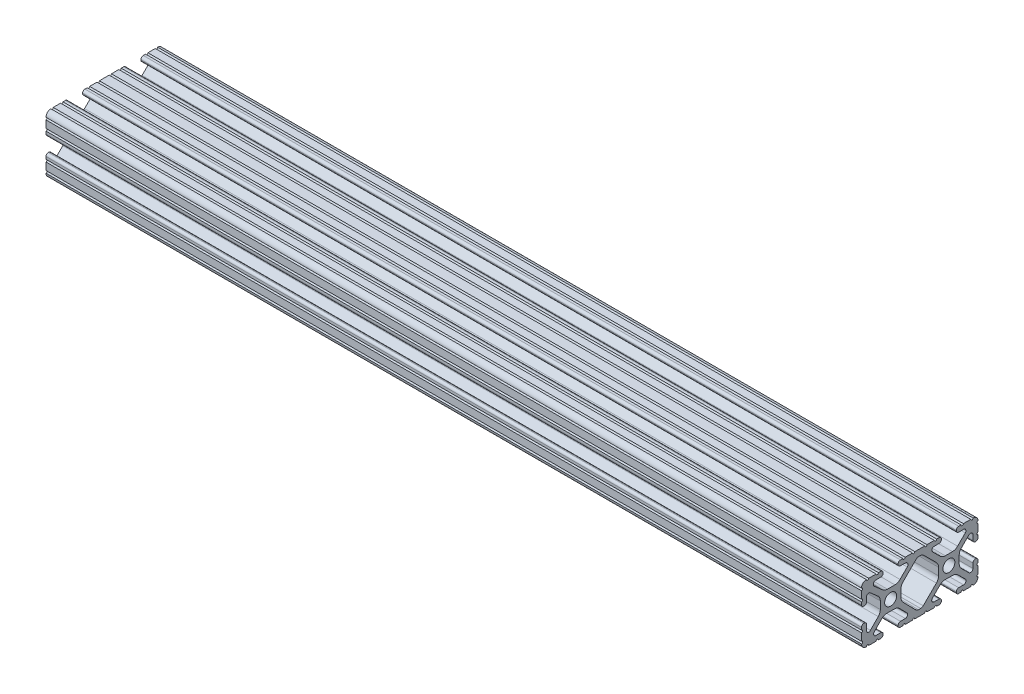
from build123d import *

# Parameters (mm, degrees)
SKETCH11_R                = 2.6035
F_10_1020_PROFILE_1_DEPTH = 355.6


with BuildPart() as part:
    # Sketch11 → 10 1020 PROFILE(1) (new body)
    with BuildSketch(Plane(origin=(0, 0, 0), x_dir=(0, 0, 1), z_dir=(1, 0, 0))):
        with BuildLine():
            Line((15.9385, 11.65104985), (15.9385, 11.53922))
            ThreePointArc((15.9385, 11.53922), (16.245750844, 10.797450844), (16.98752, 10.4902))
            Line((16.98752, 10.4902), (19.116384363, 10.4902))
            ThreePointArc((19.116384363, 10.4902), (20.052502933, 9.869096983), (19.844087081, 8.765172272))
            Line((19.844087081, 8.765172272), (16.618993479, 5.455112286))
            ThreePointArc((16.618993479, 5.455112286), (15.578994274, 4.745442459), (14.344932584, 4.4958))
            Line((14.344932584, 4.4958), (11.083317835, 4.4958))
            ThreePointArc((11.083317835, 4.4958), (9.854330953, 4.743306833), (8.816955189, 5.447238587))
            Line((8.816955189, 5.447238587), (5.564154119, 8.762652677))
            ThreePointArc((5.564154119, 8.762652677), (5.352591412, 9.867473037), (6.289393385, 10.4902))
            Line((6.289393385, 10.4902), (8.41248, 10.4902))
            ThreePointArc((8.41248, 10.4902), (9.154249156, 10.797450844), (9.4615, 11.53922))
            Line((9.4615, 11.53922), (9.4615, 11.65104985))
            ThreePointArc((9.4615, 11.65104985), (9.154269614, 12.392769614), (8.41254985, 12.7))
            Line((8.41254985, 12.7), (7.38288465, 12.7))
            ThreePointArc((7.38288465, 12.7), (6.87488465, 12.192), (6.36688465, 12.7))
            Line((6.36688465, 12.7), (3.14958095, 12.7))
            ThreePointArc((3.14958095, 12.7), (2.64158095, 12.192), (2.13358095, 12.7))
            Line((2.13358095, 12.7), (-2.13358095, 12.7))
            ThreePointArc((-2.13358095, 12.7), (-2.64158095, 12.192), (-3.14958095, 12.7))
            Line((-3.14958095, 12.7), (-6.36689735, 12.7))
            ThreePointArc((-6.36689735, 12.7), (-6.87489735, 12.192), (-7.38289735, 12.7))
            Line((-7.38289735, 12.7), (-8.41254985, 12.7))
            ThreePointArc((-8.41254985, 12.7), (-9.154269614, 12.392769614), (-9.4615, 11.65104985))
            Line((-9.4615, 11.65104985), (-9.4615, 11.53922))
            ThreePointArc((-9.4615, 11.53922), (-9.154249156, 10.797450844), (-8.41248, 10.4902))
            Line((-8.41248, 10.4902), (-6.283641037, 10.4902))
            ThreePointArc((-6.283641037, 10.4902), (-5.297291557, 9.829633109), (-5.532576693, 8.666071843))
            Line((-5.532576693, 8.666071843), (-8.809985098, 5.416263103))
            ThreePointArc((-8.809985098, 5.416263103), (-9.836720513, 4.734920264), (-11.045536121, 4.4958))
            Line((-11.045536121, 4.4958), (-14.354463879, 4.4958))
            ThreePointArc((-14.354463879, 4.4958), (-15.563279487, 4.734920264), (-16.590014902, 5.416263103))
            Line((-16.590014902, 5.416263103), (-19.867423307, 8.666071843))
            ThreePointArc((-19.867423307, 8.666071843), (-20.102708443, 9.829633109), (-19.116358963, 10.4902))
            Line((-19.116358963, 10.4902), (-16.98752, 10.4902))
            ThreePointArc((-16.98752, 10.4902), (-16.245750844, 10.797450844), (-15.9385, 11.53922))
            Line((-15.9385, 11.53922), (-15.9385, 11.65104985))
            ThreePointArc((-15.9385, 11.65104985), (-16.245730386, 12.392769614), (-16.98745015, 12.7))
            Line((-16.98745015, 12.7), (-18.01711535, 12.7))
            ThreePointArc((-18.01711535, 12.7), (-18.52511535, 12.192), (-19.03311535, 12.7))
            Line((-19.03311535, 12.7), (-22.2504, 12.7))
            ThreePointArc((-22.2504, 12.7), (-22.758323491, 12.192000006), (-23.266399977, 12.699846982))
            ThreePointArc((-23.266399977, 12.699846982), (-24.782522516, 12.082522516), (-25.399846982, 10.566399977))
            ThreePointArc((-25.399846982, 10.566399977), (-24.892000006, 10.058323491), (-25.4, 9.5504))
            Line((-25.4, 9.5504), (-25.4, 6.3330836))
            ThreePointArc((-25.4, 6.3330836), (-24.892, 5.8250836), (-25.4, 5.3170836))
            Line((-25.4, 5.3170836), (-25.4, 4.237520184))
            ThreePointArc((-25.4, 4.237520184), (-25.107393763, 3.531106237), (-24.400979816, 3.2385))
            Line((-24.400979816, 3.2385), (-24.23922, 3.2385))
            ThreePointArc((-24.23922, 3.2385), (-23.497450844, 3.545750844), (-23.1902, 4.28752))
            Line((-23.1902, 4.28752), (-23.1902, 6.334741132))
            ThreePointArc((-23.1902, 6.334741132), (-22.556026952, 7.286023527), (-21.434002553, 7.066535717))
            Line((-21.434002553, 7.066535717), (-18.147950853, 3.808156468))
            ThreePointArc((-18.147950853, 3.808156468), (-17.452759693, 2.774838327), (-17.208501877, 1.553619571))
            Line((-17.208501877, 1.553619571), (-17.208501877, -1.695179196))
            ThreePointArc((-17.208501877, -1.695179196), (-17.450738657, -2.911536421), (-18.140486065, -3.942289578))
            Line((-18.140486065, -3.942289578), (-21.431579576, -7.227386226))
            ThreePointArc((-21.431579576, -7.227386226), (-22.55444896, -7.449940594), (-23.1902, -6.498002195))
            Line((-23.1902, -6.498002195), (-23.1902, -4.28752))
            ThreePointArc((-23.1902, -4.28752), (-23.497450844, -3.545750844), (-24.23922, -3.2385))
            Line((-24.23922, -3.2385), (-24.35098, -3.2385))
            ThreePointArc((-24.35098, -3.2385), (-25.092749156, -3.545750844), (-25.4, -4.28752))
            Line((-25.4, -4.28752), (-25.4, -5.3171344))
            ThreePointArc((-25.4, -5.3171344), (-24.892, -5.8251344), (-25.4, -6.3331344))
            Line((-25.4, -6.3331344), (-25.4, -9.5504))
            ThreePointArc((-25.4, -9.5504), (-24.892000006, -10.058323491), (-25.399846982, -10.566399977))
            ThreePointArc((-25.399846982, -10.566399977), (-24.782522516, -12.082522516), (-23.266399977, -12.699846982))
            ThreePointArc((-23.266399977, -12.699846982), (-22.758323491, -12.192000006), (-22.2504, -12.7))
            Line((-22.2504, -12.7), (-19.03308995, -12.7))
            ThreePointArc((-19.03308995, -12.7), (-18.52508995, -12.192), (-18.01708995, -12.7))
            Line((-18.01708995, -12.7), (-16.9874692, -12.7))
            ThreePointArc((-16.9874692, -12.7), (-16.245700044, -12.392749156), (-15.9384492, -11.65098))
            Line((-15.9384492, -11.65098), (-15.9384492, -11.53922))
            ThreePointArc((-15.9384492, -11.53922), (-16.245700044, -10.797450844), (-16.9874692, -10.4902))
            Line((-16.9874692, -10.4902), (-19.116358963, -10.4902))
            ThreePointArc((-19.116358963, -10.4902), (-20.055197748, -9.862578342), (-19.834124023, -8.755124678))
            Line((-19.834124023, -8.755124678), (-16.49660751, -5.423689618))
            ThreePointArc((-16.49660751, -5.423689618), (-15.467274017, -4.736928798), (-14.253591699, -4.4958))
            Line((-14.253591699, -4.4958), (-11.146408301, -4.4958))
            ThreePointArc((-11.146408301, -4.4958), (-9.932725983, -4.736928798), (-8.90339249, -5.423689618))
            Line((-8.90339249, -5.423689618), (-5.565875977, -8.755124678))
            ThreePointArc((-5.565875977, -8.755124678), (-5.344802252, -9.862578342), (-6.283641037, -10.4902))
            Line((-6.283641037, -10.4902), (-8.4125308, -10.4902))
            ThreePointArc((-8.4125308, -10.4902), (-9.154299956, -10.797450844), (-9.4615508, -11.53922))
            Line((-9.4615508, -11.53922), (-9.4615508, -11.65098))
            ThreePointArc((-9.4615508, -11.65098), (-9.154299956, -12.392749156), (-8.4125308, -12.7))
            Line((-8.4125308, -12.7), (-7.38287195, -12.7))
            ThreePointArc((-7.38287195, -12.7), (-6.87487195, -12.192), (-6.36687195, -12.7))
            Line((-6.36687195, -12.7), (-3.14960635, -12.7))
            ThreePointArc((-3.14960635, -12.7), (-2.64160635, -12.192), (-2.13360635, -12.7))
            Line((-2.13360635, -12.7), (2.13360635, -12.7))
            ThreePointArc((2.13360635, -12.7), (2.64159365, -12.1920127), (3.14958095, -12.7))
            Line((3.14958095, -12.7), (6.36691005, -12.7))
            ThreePointArc((6.36691005, -12.7), (6.87491005, -12.192), (7.38291005, -12.7))
            Line((7.38291005, -12.7), (8.4125308, -12.7))
            ThreePointArc((8.4125308, -12.7), (9.154299956, -12.392749156), (9.4615508, -11.65098))
            Line((9.4615508, -11.65098), (9.4615508, -11.53922))
            ThreePointArc((9.4615508, -11.53922), (9.154299956, -10.797450844), (8.4125308, -10.4902))
            Line((8.4125308, -10.4902), (6.289393385, -10.4902))
            ThreePointArc((6.289393385, -10.4902), (5.231590322, -9.783049717), (5.480677245, -8.535265862))
            Line((5.480677245, -8.535265862), (8.597933595, -5.423689618))
            ThreePointArc((8.597933595, -5.423689618), (9.627267088, -4.736928798), (10.840949406, -4.4958))
            Line((10.840949406, -4.4958), (14.102564155, -4.4958))
            ThreePointArc((14.102564155, -4.4958), (15.215927525, -4.697410182), (16.187895372, -5.276636531))
            Line((16.187895372, -5.276636531), (19.868247549, -8.482246082))
            ThreePointArc((19.868247549, -8.482246082), (20.188435806, -9.746879864), (19.116384363, -10.4902))
            Line((19.116384363, -10.4902), (16.9874692, -10.4902))
            ThreePointArc((16.9874692, -10.4902), (16.245700044, -10.797450844), (15.9384492, -11.53922))
            Line((15.9384492, -11.53922), (15.9384492, -11.65098))
            ThreePointArc((15.9384492, -11.65098), (16.245700044, -12.392749156), (16.9874692, -12.7))
            Line((16.9874692, -12.7), (18.01710265, -12.7))
            ThreePointArc((18.01710265, -12.7), (18.52510265, -12.192), (19.03310265, -12.7))
            Line((19.03310265, -12.7), (22.2504, -12.7))
            ThreePointArc((22.2504, -12.7), (22.758323491, -12.192000006), (23.266399977, -12.699846982))
            ThreePointArc((23.266399977, -12.699846982), (24.782522516, -12.082522516), (25.399846982, -10.566399977))
            ThreePointArc((25.399846982, -10.566399977), (24.892000006, -10.058323492), (25.4, -9.550400001))
            Line((25.4, -9.550400001), (25.4, -6.333083592))
            ThreePointArc((25.4, -6.333083592), (24.892000001, -5.825083593), (25.4, -5.317083593))
            Line((25.4, -5.317083593), (25.4, -4.237520184))
            ThreePointArc((25.4, -4.237520184), (25.107393763, -3.531106237), (24.400979816, -3.2385))
            Line((24.400979816, -3.2385), (24.189220184, -3.2385))
            ThreePointArc((24.189220184, -3.2385), (23.482806237, -3.531106237), (23.1902, -4.237520184))
            Line((23.1902, -4.237520184), (23.1902, -6.155876159))
            ThreePointArc((23.1902, -6.155876159), (22.62232736, -7.038258539), (21.583974541, -6.886926384))
            Line((21.583974541, -6.886926384), (18.29817066, -4.024970844))
            ThreePointArc((18.29817066, -4.024970844), (17.493730985, -2.946044689), (17.208501877, -1.630807374))
            Line((17.208501877, -1.630807374), (17.208501877, 1.630807374))
            ThreePointArc((17.208501877, 1.630807374), (17.442348332, 2.82673414), (18.109440981, 3.846495088))
            Line((18.109440981, 3.846495088), (21.526346532, 7.353420386))
            ThreePointArc((21.526346532, 7.353420386), (22.585896263, 7.574939077), (23.1902, 6.676867167))
            Line((23.1902, 6.676867167), (23.1902, 4.237520184))
            ThreePointArc((23.1902, 4.237520184), (23.482806237, 3.531106237), (24.189220184, 3.2385))
            Line((24.189220184, 3.2385), (24.400979816, 3.2385))
            ThreePointArc((24.400979816, 3.2385), (25.107393763, 3.531106237), (25.4, 4.237520184))
            Line((25.4, 4.237520184), (25.4, 5.3170836))
            ThreePointArc((25.4, 5.3170836), (24.891949193, 5.825134407), (25.4, 6.333185215))
            Line((25.4, 6.333185215), (25.4, 9.550400015))
            ThreePointArc((25.4, 9.550400015), (24.892000013, 10.058323498), (25.399846982, 10.566399977))
            ThreePointArc((25.399846982, 10.566399977), (24.782522516, 12.082522516), (23.266399977, 12.699846982))
            ThreePointArc((23.266399977, 12.699846982), (22.758323491, 12.192000006), (22.2504, 12.7))
            Line((22.2504, 12.7), (19.03310265, 12.7))
            ThreePointArc((19.03310265, 12.7), (18.52510265, 12.192), (18.01710265, 12.7))
            Line((18.01710265, 12.7), (16.98745015, 12.7))
            ThreePointArc((16.98745015, 12.7), (16.245730386, 12.392769614), (15.9385, 11.65104985))
        make_face()
        with Locations((-12.7, 0)):
            Circle(SKETCH11_R, mode=Mode.SUBTRACT)
        with Locations((12.7, 0)):
            Circle(SKETCH11_R, mode=Mode.SUBTRACT)
        with BuildLine():
            Line((-8.191498123, 1.622302656), (-8.191498123, -1.622302656))
            ThreePointArc((-8.191498123, -1.622302656), (-7.949261343, -2.838659881), (-7.259513935, -3.869413038))
            Line((-7.259513935, -3.869413038), (-1.545748891, -9.572766749))
            ThreePointArc((-1.545748891, -9.572766749), (-1.035199478, -9.913400116), (-0.433213048, -10.033))
            Line((-0.433213048, -10.033), (0.433213048, -10.033))
            ThreePointArc((0.433213048, -10.033), (1.035199478, -9.913400116), (1.545748891, -9.572766749))
            Line((1.545748891, -9.572766749), (7.259513935, -3.869413038))
            ThreePointArc((7.259513935, -3.869413038), (7.949261343, -2.838659881), (8.191498123, -1.622302656))
            Line((8.191498123, -1.622302656), (8.191498123, 1.622302656))
            ThreePointArc((8.191498123, 1.622302656), (7.955573352, 2.823327967), (7.282860769, 3.845864069))
            Line((7.282860769, 3.845864069), (1.675572808, 9.561086461))
            ThreePointArc((1.675572808, 9.561086461), (1.161034429, 9.910236611), (0.551456936, 10.033))
            Line((0.551456936, 10.033), (-0.395199982, 10.033))
            ThreePointArc((-0.395199982, 10.033), (-0.994772524, 9.914396349), (-1.50403329, 9.576450301))
            Line((-1.50403329, 9.576450301), (-7.252049147, 3.876839553))
            ThreePointArc((-7.252049147, 3.876839553), (-7.947240307, 2.843521412), (-8.191498123, 1.622302656))
        make_face(mode=Mode.SUBTRACT)
    extrude(amount=F_10_1020_PROFILE_1_DEPTH)


solid = part.part
